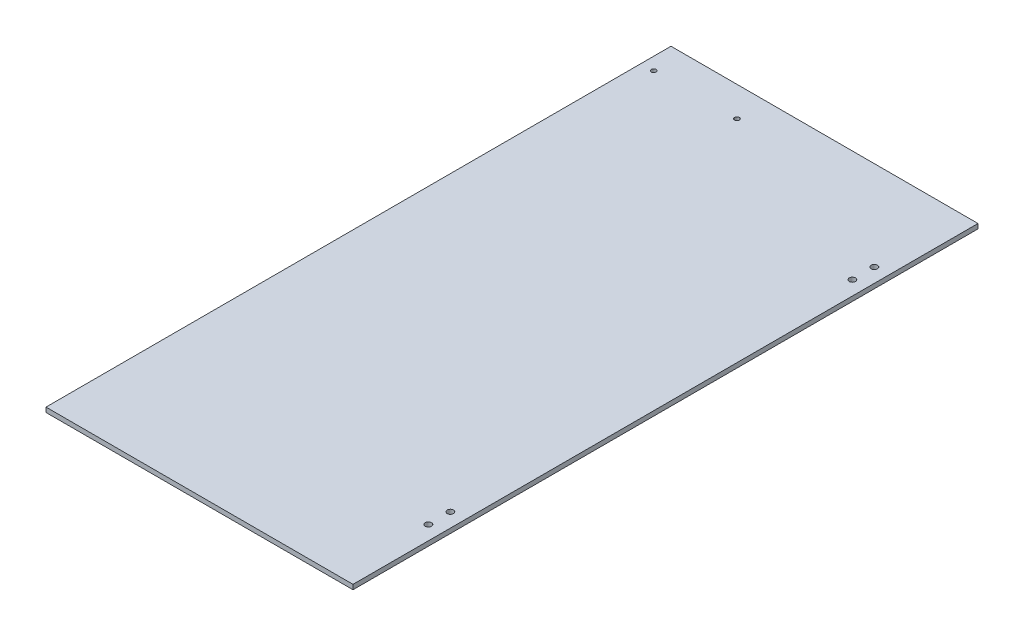
from build123d import *

# Parameters (mm, degrees)
SKETCH1_W           = 193
SKETCH1_H           = 400
BOSS_EXTRUDE1_DEPTH = 3
SKETCH2_R           = 1.5
CUT_EXTRUDE1_DEPTH  = 10
SKETCH3_R           = 2
CUT_EXTRUDE2_DEPTH  = 10
SKETCH4_W           = 248.590702278
SKETCH4_H           = 43.310012617
CUT_EXTRUDE3_DEPTH  = 1
SKETCH5_W           = 316.199587927
SKETCH5_H           = 81.961296772
CUT_EXTRUDE4_DEPTH  = 1
THICKEN1_T1         = 3
SKETCH6_W           = 457.051709452
SKETCH6_H           = 116.920204743
CUT_EXTRUDE5_DEPTH  = 0.5


with BuildPart() as part:
    # Sketch1 → Boss-Extrude1 (new body)
    with BuildSketch(Plane(origin=(0, -196.798939869, 0), x_dir=(1, 0, 0), z_dir=(0, 1, 0))):
        with Locations((9.289156386, -589.620141885)):
            Rectangle(SKETCH1_W, SKETCH1_H)
    extrude(amount=BOSS_EXTRUDE1_DEPTH)

    # Sketch2 → Cut-Extrude1 (cut)
    with BuildSketch(Plane(origin=(0, -193.798939869, 0), x_dir=(1, 0, 0), z_dir=(0, 1, 0))):
        with Locations(Location((-78.710843614, -409.620141885, 0), (0, 0, 270))):
            Circle(SKETCH2_R)
        with Locations(Location((-25.710843614, -409.620141885, 0), (0, 0, 270))):
            Circle(SKETCH2_R)
    extrude(amount=-CUT_EXTRUDE1_DEPTH, mode=Mode.SUBTRACT)

    # Sketch3 → Cut-Extrude2 (cut)
    with BuildSketch(Plane.XZ.offset(196.798939869)):
        with Locations(Location((99.789156386, 731.620141885, 0), (0, 0, 270))):
            Circle(SKETCH3_R)
        with Locations(Location((99.789156386, 717.620141885, 0), (0, 0, 270))):
            Circle(SKETCH3_R)
        with Locations(Location((99.789156386, 461.620141885, 0), (0, 0, 90))):
            Circle(SKETCH3_R)
        with Locations(Location((99.789156386, 447.620141885, 0), (0, 0, 90))):
            Circle(SKETCH3_R)
    extrude(amount=-CUT_EXTRUDE2_DEPTH, mode=Mode.SUBTRACT)

    # Sketch4 → Cut-Extrude3 (cut)
    with BuildSketch(Plane.XY.offset(789.620141885)):
        with Locations((-1.481434532, -204.805293431)):
            Rectangle(SKETCH4_W, SKETCH4_H)
    extrude(amount=-CUT_EXTRUDE3_DEPTH, mode=Mode.SUBTRACT)

    # Sketch5 → Cut-Extrude4 (cut)
    with BuildSketch(Plane(origin=(0, 0, 389.620141885), x_dir=(-1, 0, 0), z_dir=(0, 0, -1))):
        with Locations((-28.05964404, -177.05881152)):
            Rectangle(SKETCH5_W, SKETCH5_H)
    extrude(amount=-CUT_EXTRUDE4_DEPTH, mode=Mode.SUBTRACT)

    # Surface-Offset1: a surface, a copy of 1 face of the part
    surface_offset1_1 = part.part.faces().sort_by_distance((105.789156386, -195.298939869, 589.620141885))[0]
    add(Solid.thicken(surface_offset1_1, THICKEN1_T1))

    # Sketch6 → Cut-Extrude5 (cut)
    with BuildSketch(Plane.ZY.offset(87.210843614)):
        with Locations((584.748466687, -192.863102271)):
            Rectangle(SKETCH6_W, SKETCH6_H)
    extrude(amount=-CUT_EXTRUDE5_DEPTH, mode=Mode.SUBTRACT)


solid = part.part
